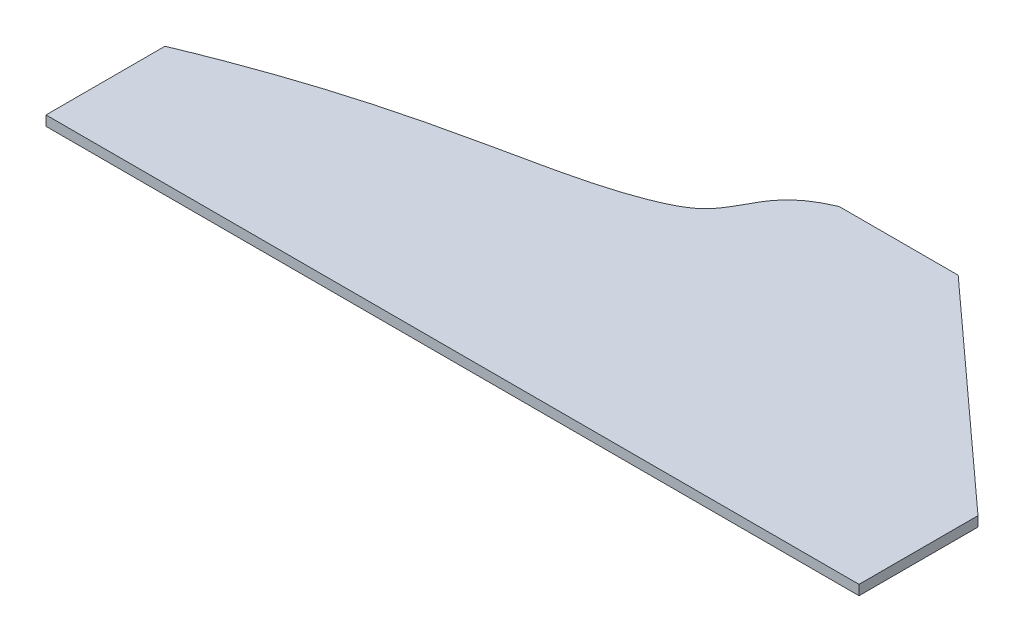
from build123d import *

# Parameters (mm, degrees)
BOSS_EXTRUDE1_DEPTH = 3.175


with BuildPart() as part:
    # Sketch1 → Boss-Extrude1 (new body)
    with BuildSketch(Plane(origin=(0, 0, 0), x_dir=(1, 0, 0), z_dir=(0, 1, 0))):
        with BuildLine():
            Line((-152.4, 0), (107.95, 0))
            Line((107.95, 0), (107.95, 38.1))
            Line((107.95, 38.1), (38.1, 101.6))
            Line((38.1, 101.6), (0, 101.6))
            add(Edge.make_bspline(
                [(-152.4, 38.1), (-93.526008547, 62.630829772), (-55.632677833, 62.244474427), (-13.235249882, 81.341283437), (-16.312722453, 94.803032311), (0, 101.6)],
                knots=[0, 0, 0, 0, 0.617418124, 0.717418124, 1, 1, 1, 1], degree=3))
            Line((-152.4, 38.1), (-152.4, 0))
        make_face()
    extrude(amount=BOSS_EXTRUDE1_DEPTH)


solid = part.part
